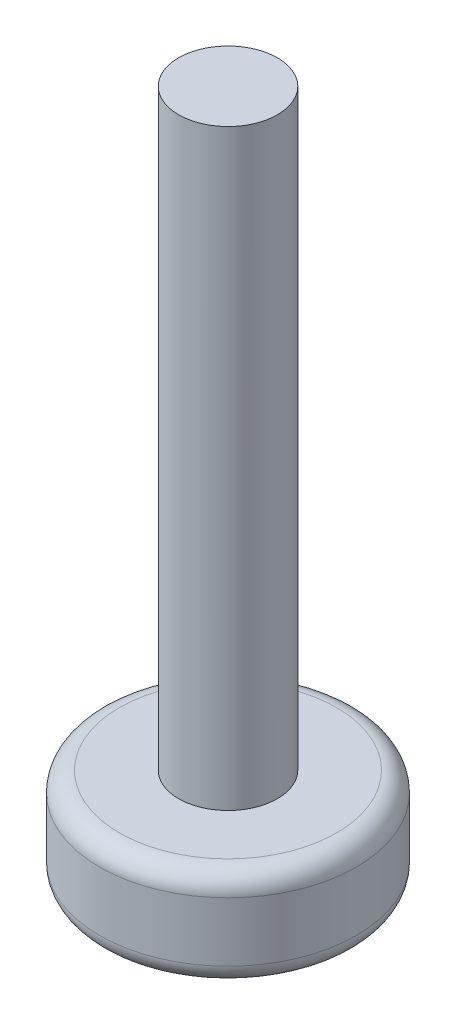
from build123d import *

# Parameters (mm, degrees)
SKETCH1_R           = 2.5
BOSS_EXTRUDE1_DEPTH = 30


with BuildPart() as part:
    # Sketch1 → Boss-Extrude1 (new body)
    with BuildSketch(Plane(origin=(0, 0, 0), x_dir=(1, 0, 0), z_dir=(0, 1, 0))):
        with Locations(Location((0, 0, 0), (0, 0, 270))):
            Circle(SKETCH1_R)
    extrude(amount=BOSS_EXTRUDE1_DEPTH)

    # Sketch2 → Revolve1 (revolve)
    with BuildSketch(Plane.XY):
        with BuildLine():
            Line((0, 0), (0, -5))
            Line((0, -5), (-5.5, -5))
            ThreePointArc((-5.5, -5), (-6.207106781, -4.707106781), (-6.5, -4))
            Line((-6.5, -4), (-6.5, -1))
            ThreePointArc((-6.5, -1), (-6.207106781, -0.292893219), (-5.5, 0))
            Line((-5.5, 0), (0, 0))
        make_face()
    revolve(axis=Axis((0, 0, 0), (0, -1, 0)))


solid = part.part
